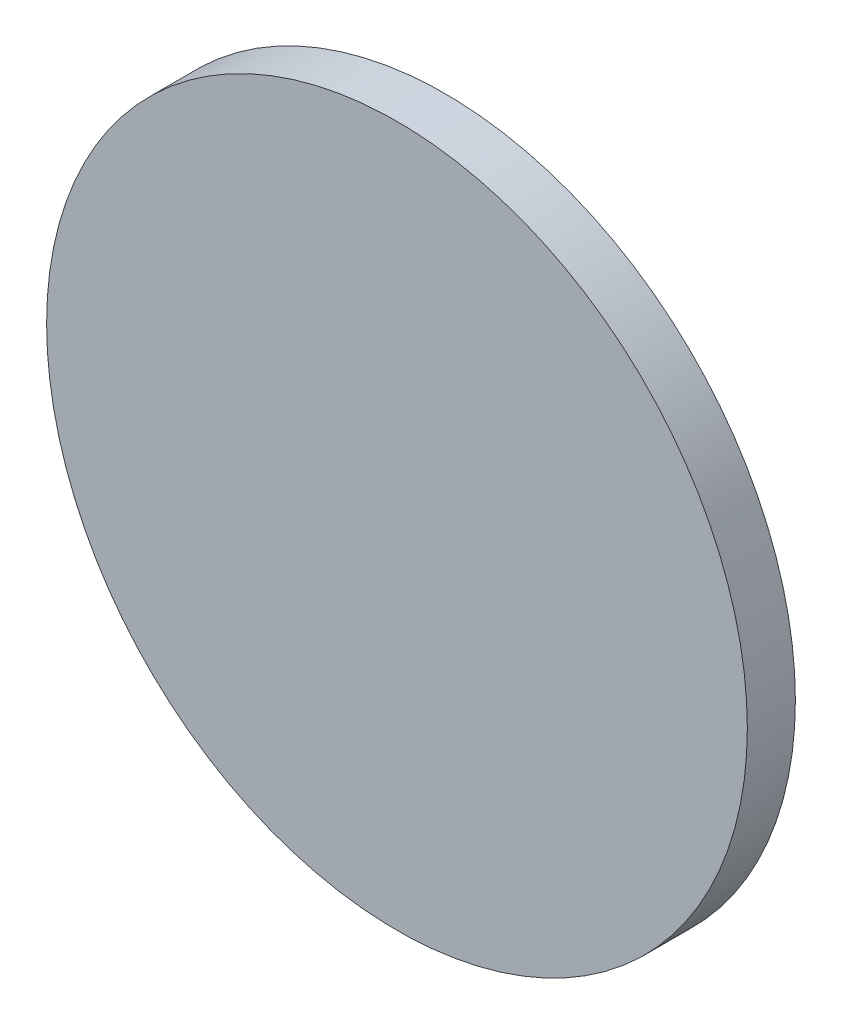
from build123d import *

# Parameters (mm, degrees)
SKETCH1_R           = 17.5
BOSS_EXTRUDE1_DEPTH = 2.4


with BuildPart() as part:
    # Sketch1 → Boss-Extrude1 (new body)
    with BuildSketch(Plane.XY):
        Circle(SKETCH1_R)
    extrude(amount=BOSS_EXTRUDE1_DEPTH)


solid = part.part
